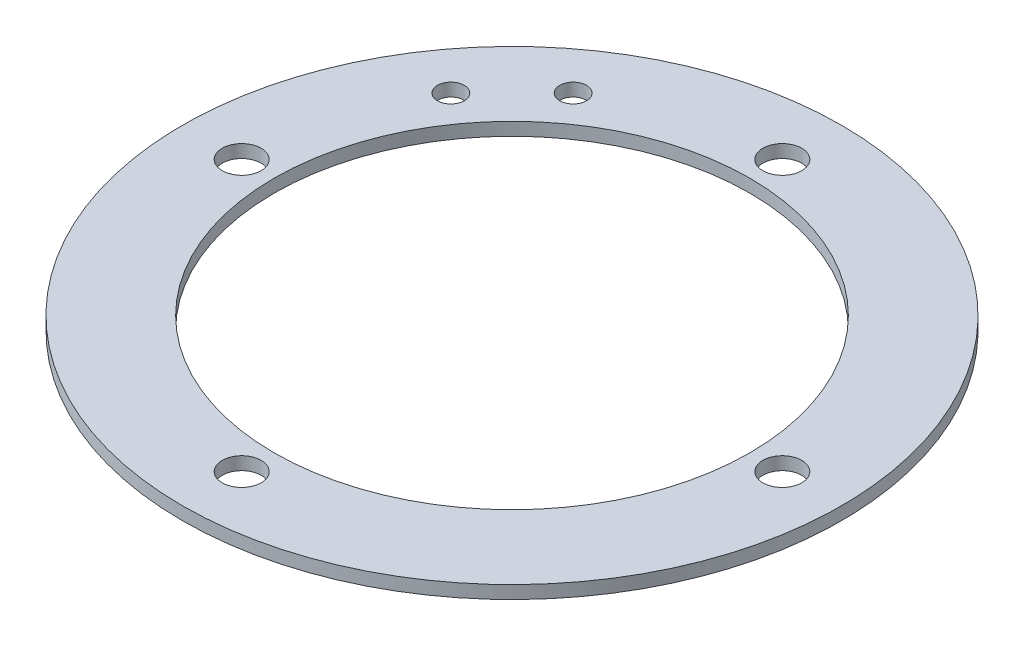
from build123d import *

# Parameters (mm, degrees)
SKETCH1_R           = 76.2
SKETCH1_R_2         = 4.5
SKETCH1_R_3         = 55
BOSS_EXTRUDE1_DEPTH = 3
SKETCH2_R           = 3.1
CUT_EXTRUDE1_DEPTH  = 3


with BuildPart() as part:
    # Sketch1 → Boss-Extrude1 (new body)
    with BuildSketch(Plane(origin=(0, 0, 0), x_dir=(1, 0, 0), z_dir=(0, 1, 0))):
        with Locations(Location((0, 0, 0), (0, 0, 270))):
            Circle(SKETCH1_R)
        with Locations(Location((0, 62.5, 0), (0, 0, 270))):
            Circle(SKETCH1_R_2, mode=Mode.SUBTRACT)
        with Locations(Location((62.5, 0, 0), (0, 0, 270))):
            Circle(SKETCH1_R_2, mode=Mode.SUBTRACT)
        with Locations(Location((0, -62.5, 0), (0, 0, 270))):
            Circle(SKETCH1_R_2, mode=Mode.SUBTRACT)
        with Locations(Location((-62.5, 0, 0), (0, 0, 270))):
            Circle(SKETCH1_R_2, mode=Mode.SUBTRACT)
        with Locations(Location((0, 0, 0), (0, 0, 270))):
            Circle(SKETCH1_R_3, mode=Mode.SUBTRACT)
    extrude(amount=BOSS_EXTRUDE1_DEPTH)

    # Sketch2 → Cut-Extrude1 (cut)
    with BuildSketch(Plane(origin=(0, 3, 0), x_dir=(1, 0, 0), z_dir=(0, 1, 0))):
        with Locations(Location((-51.618795027, 37.476659403, 0), (0, 0, 270))):
            Circle(SKETCH2_R)
        with Locations(Location((-37.476659403, 51.618795027, 0), (0, 0, 270))):
            Circle(SKETCH2_R)
    extrude(amount=-CUT_EXTRUDE1_DEPTH, mode=Mode.SUBTRACT)


solid = part.part
